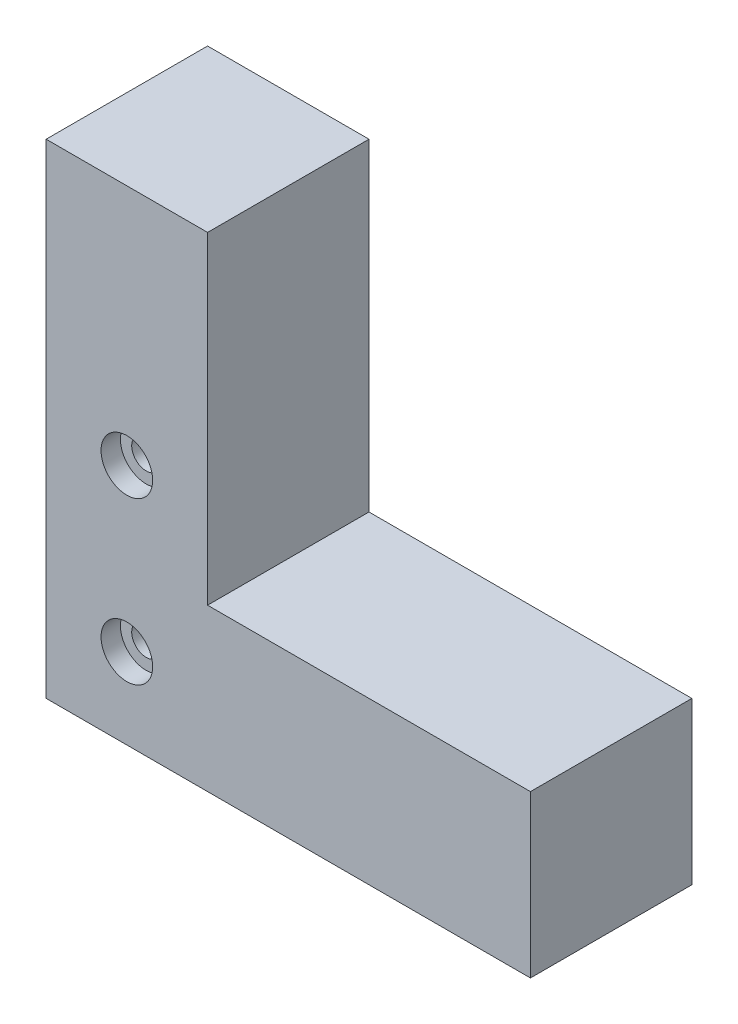
from build123d import *

# Parameters (mm, degrees)
BOSS_EXTRUDE1_DEPTH = 25
SKETCH2_R           = 2.25
CUT_EXTRUDE1_DEPTH  = 25
SKETCH3_R           = 4
CUT_EXTRUDE2_DEPTH  = 3


with BuildPart() as part:
    # Sketch1 → Boss-Extrude1 (new body)
    with BuildSketch(Plane.XY):
        Polygon((-25, -25), (50, -25), (50, 0), (0, 0), (0, 50), (-25, 50), align=None)
    extrude(amount=BOSS_EXTRUDE1_DEPTH)

    # Sketch2 → Cut-Extrude1 (cut)
    with BuildSketch(Plane.XY.offset(25)):
        with Locations((-12.5, -12.5)):
            Circle(SKETCH2_R)
        with Locations((-12.5, 12.5)):
            Circle(SKETCH2_R)
    extrude(amount=-CUT_EXTRUDE1_DEPTH, mode=Mode.SUBTRACT)

    # Sketch3 → Cut-Extrude2 (cut)
    with BuildSketch(Plane.XY.offset(25)):
        with Locations((-12.5, 12.5)):
            Circle(SKETCH3_R)
        with Locations((-12.5, -12.5)):
            Circle(SKETCH3_R)
    extrude(amount=-CUT_EXTRUDE2_DEPTH, mode=Mode.SUBTRACT)


solid = part.part
